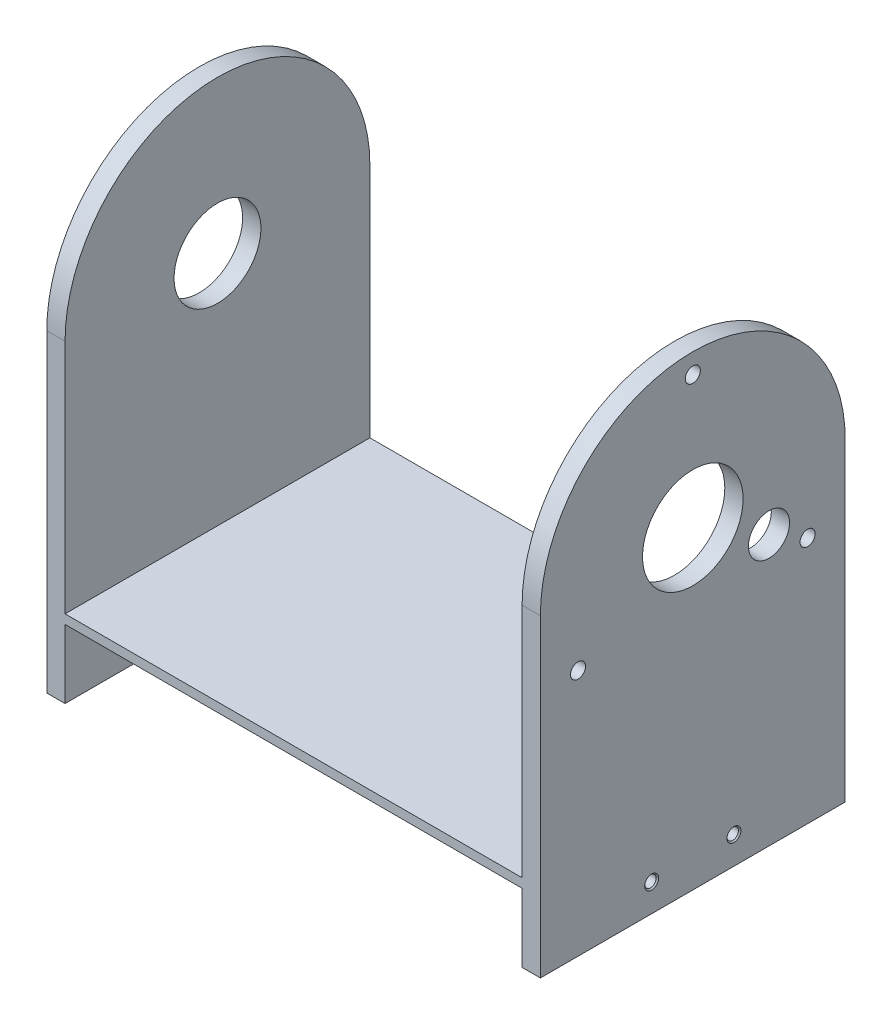
from build123d import *

# Parameters (mm, degrees)
SKETCH_1_W                   = 40
SKETCH_1_H                   = 66.7
EXTRUDE_1_DEPTH              = 2
SKETCH_2_W                   = 4
SKETCH_2_H                   = 66.7
EXTRUDE_2_DEPTH              = 100
CUT_EXTRUDE_1_DEPTH          = 115.526077816
CUT_EXTRUDE_1_DEPTH_BACK     = 115.526077816
HOLE_WIZARD_M4_1_D           = 3.3
HOLE_WIZARD_M4_1_CSINK_D     = 4.05
HOLE_WIZARD_M4_1_CSINK_ANGLE = 90
HOLE_WIZARD_M4_2_AT_2_COUNT  = 2
HOLE_WIZARD_M4_2_AT_2_PITCH  = 68.59294731
HOLE_WIZARD_M4_2_AT_3_COUNT  = 2
HOLE_WIZARD_M4_2_AT_3_PITCH  = 26
HOLE_WIZARD_M4_2_AT_4_COUNT  = 2
HOLE_WIZARD_M4_2_AT_4_PITCH  = 62.376998966
HOLE_WIZARD_M4_2_AT_5_COUNT  = 2
HOLE_WIZARD_M4_2_AT_5_PITCH  = 56.7
SKETCH_11_W                  = 66.7
SKETCH_11_H                  = 2
EXTRUDE_3_DEPTH              = 100
SKETCH_13_W                  = 40
SKETCH_13_H                  = 66.7
EXTRUDE_4_DEPTH              = 2
SKETCH_14_W                  = 4
SKETCH_14_H                  = 66.7
EXTRUDE_5_DEPTH              = 100
CUT_EXTRUDE_2_DEPTH          = 180.589037806
CUT_EXTRUDE_2_DEPTH_BACK     = 180.589037806
HOLE_WIZARD_M4_3_AT_2_COUNT  = 2
HOLE_WIZARD_M4_3_AT_2_PITCH  = 26
HOLE_WIZARD_M4_3_AT_3_COUNT  = 2
HOLE_WIZARD_M4_3_AT_3_PITCH  = 62.376998966
HOLE_WIZARD_M4_3_AT_4_COUNT  = 2
HOLE_WIZARD_M4_3_AT_4_PITCH  = 56.7
CUT_EXTRUDE_3_REACH          = 181.589
SKETCH_18_R                  = 9.5
CUT_EXTRUDE_4_REACH          = 181.589
SKETCH_21_R                  = 11
CUT_EXTRUDE_5_REACH          = 181.589
SKETCH_22_R                  = 4.5
FILLET_1_R                   = 2
CUT_EXTRUDE_6_REACH          = 193.604
SKETCH_23_W                  = 36
SKETCH_23_H                  = 66.7
CUT_EXTRUDE_7_REACH          = 164.752
SKETCH_24_W                  = 36
SKETCH_24_H                  = 66.7
HOLE_WIZARD_M3_1_D           = 2.5
HOLE_WIZARD_M3_1_CSINK_D     = 3.05
HOLE_WIZARD_M3_1_CSINK_ANGLE = 90


with BuildPart() as part:
    # 草图1 → 凸台-拉伸1 (new body)
    with BuildSketch(Plane(origin=(0, 0, 0), x_dir=(1, 0, 0), z_dir=(0, 1, 0))):
        Rectangle(SKETCH_1_W, SKETCH_1_H)
    extrude(amount=EXTRUDE_1_DEPTH)

    # 草图2 → 凸台-拉伸2 (add)
    with BuildSketch(Plane(origin=(0, 2, 0), x_dir=(1, 0, 0), z_dir=(0, 1, 0))):
        with Locations((-18, 0)):
            Rectangle(SKETCH_2_W, SKETCH_2_H)
    extrude(amount=EXTRUDE_2_DEPTH)

    # 草图5 → 切除-拉伸1 (cut, two sides: drawn at the far end of the back side and taken through both)
    with BuildSketch(Plane.ZY.offset(20).offset(-CUT_EXTRUDE_1_DEPTH_BACK)):
        with BuildLine():
            ThreePointArc((0, 102), (23.582011153, 92.232011153), (33.35, 68.65))
            Line((33.35, 68.65), (33.35, 102))
            Line((33.35, 102), (0, 102))
        make_face()
        with BuildLine():
            ThreePointArc((-33.35, 68.65), (-23.582011153, 92.232011153), (0, 102))
            Line((0, 102), (-33.35, 102))
            Line((-33.35, 102), (-33.35, 68.65))
        make_face()
    extrude(amount=CUT_EXTRUDE_1_DEPTH + CUT_EXTRUDE_1_DEPTH_BACK, mode=Mode.SUBTRACT)

    # M4 螺纹孔1 (through all)
    with Locations(Plane.ZY.offset(20)):
        with Locations((0, 97.65), (25.11473671, 54.15), (-25.11473671, 54.15)):
            CounterSinkHole(HOLE_WIZARD_M4_1_D / 2, HOLE_WIZARD_M4_1_CSINK_D / 2, counter_sink_angle=HOLE_WIZARD_M4_1_CSINK_ANGLE)

    # 草图10 → M4 螺纹孔2 (revolve, cut)
    with BuildSketch(Plane(origin=(15, 2, -28.35), x_dir=(0, 0, 1), z_dir=(1, 0, 0))):
        Polygon((0, 0), (0, 2), (1.65, 2), (1.65, 0.375), (2.025, 0), align=None)
    hole_wizard_m4_2 = revolve(axis=Axis((15, 8.35, -28.35), (0, -1, 0)), mode=Mode.SUBTRACT)

    # M4 螺纹孔2 at 2: M4 螺纹孔2 ×2
    with Locations(*[Vector(-0.9508085645250022, 0, 0.3097790722852413) * (i * HOLE_WIZARD_M4_2_AT_2_PITCH) for i in range(1, HOLE_WIZARD_M4_2_AT_2_COUNT)]):
        add(hole_wizard_m4_2, mode=Mode.SUBTRACT)

    # M4 螺纹孔2 at 3: M4 螺纹孔2 ×2
    with Locations(*[(-i * HOLE_WIZARD_M4_2_AT_3_PITCH, 0, 0) for i in range(1, HOLE_WIZARD_M4_2_AT_3_COUNT)]):
        add(hole_wizard_m4_2, mode=Mode.SUBTRACT)

    # M4 螺纹孔2 at 4: M4 螺纹孔2 ×2
    with Locations(*[Vector(-0.4168203092647413, 0, 0.9089889052042635) * (i * HOLE_WIZARD_M4_2_AT_4_PITCH) for i in range(1, HOLE_WIZARD_M4_2_AT_4_COUNT)]):
        add(hole_wizard_m4_2, mode=Mode.SUBTRACT)

    # M4 螺纹孔2 at 5: M4 螺纹孔2 ×2
    with Locations(*[(0, 0, i * HOLE_WIZARD_M4_2_AT_5_PITCH) for i in range(1, HOLE_WIZARD_M4_2_AT_5_COUNT)]):
        add(hole_wizard_m4_2, mode=Mode.SUBTRACT)

    # 草图11 → 凸台-拉伸3 (add)
    with BuildSketch(Plane.ZY.offset(20)):
        with Locations((0, 16)):
            Rectangle(SKETCH_11_W, SKETCH_11_H)
    extrude(amount=EXTRUDE_3_DEPTH)



with BuildPart() as body_2:
    # 草图13 → 凸台-拉伸4 (new body)
    with BuildSketch(Plane(origin=(0, 0, 0), x_dir=(1, 0, 0), z_dir=(0, 1, 0))):
        with Locations((-140, 0)):
            Rectangle(SKETCH_13_W, SKETCH_13_H)
    extrude(amount=EXTRUDE_4_DEPTH)


with BuildPart() as part_1:
    add(part.part)

    add(body_2.part)  # 凸台-拉伸5 merges body 2
    # 草图14 → 凸台-拉伸5 (add)
    with BuildSketch(Plane(origin=(0, 2, 0), x_dir=(1, 0, 0), z_dir=(0, 1, 0))):
        with Locations((-122, 0)):
            Rectangle(SKETCH_14_W, SKETCH_14_H)
    extrude(amount=EXTRUDE_5_DEPTH)

    # 草图15 → 切除-拉伸2 (cut, two sides: drawn at the far end of the back side and taken through both)
    with BuildSketch(Plane.ZY.offset(124).offset(-CUT_EXTRUDE_2_DEPTH_BACK)):
        with BuildLine():
            ThreePointArc((0, 102), (23.582011153, 92.232011153), (33.35, 68.65))
            Line((33.35, 68.65), (33.35, 102))
            Line((33.35, 102), (0, 102))
        make_face()
        with BuildLine():
            ThreePointArc((-33.35, 68.65), (-23.582011153, 92.232011153), (0, 102))
            Line((0, 102), (-33.35, 102))
            Line((-33.35, 102), (-33.35, 68.65))
        make_face()
    extrude(amount=CUT_EXTRUDE_2_DEPTH + CUT_EXTRUDE_2_DEPTH_BACK, mode=Mode.SUBTRACT)

    # 草图17 → M4 螺纹孔3 (revolve, cut)
    with BuildSketch(Plane(origin=(-129, 2, -28.35), x_dir=(0, 0, 1), z_dir=(1, 0, 0))):
        Polygon((0, 0), (0, 2), (1.65, 2), (1.65, 0.375), (2.025, 0), align=None)
    hole_wizard_m4_3 = revolve(axis=Axis((-129, 8.35, -28.35), (0, -1, 0)), mode=Mode.SUBTRACT)

    # M4 螺纹孔3 at 2: M4 螺纹孔3 ×2
    with Locations(*[(-i * HOLE_WIZARD_M4_3_AT_2_PITCH, 0, 0) for i in range(1, HOLE_WIZARD_M4_3_AT_2_COUNT)]):
        add(hole_wizard_m4_3, mode=Mode.SUBTRACT)

    # M4 螺纹孔3 at 3: M4 螺纹孔3 ×2
    with Locations(*[Vector(-0.41682030926474106, 0, 0.9089889052042636) * (i * HOLE_WIZARD_M4_3_AT_3_PITCH) for i in range(1, HOLE_WIZARD_M4_3_AT_3_COUNT)]):
        add(hole_wizard_m4_3, mode=Mode.SUBTRACT)

    # M4 螺纹孔3 at 4: M4 螺纹孔3 ×2
    with Locations(*[(0, 0, i * HOLE_WIZARD_M4_3_AT_4_PITCH) for i in range(1, HOLE_WIZARD_M4_3_AT_4_COUNT)]):
        add(hole_wizard_m4_3, mode=Mode.SUBTRACT)

    # 草图18 → 切除-拉伸3 (cut, up to next)
    with BuildSketch(Plane.ZY.offset(124), mode=Mode.PRIVATE) as cut_extrude_3_sk1:
        with Locations((0, 68.65)):
            Circle(SKETCH_18_R)
    cut_extrude_3_tool1 = extrude(cut_extrude_3_sk1.sketch, amount=-CUT_EXTRUDE_3_REACH, mode=Mode.PRIVATE) & part_1.part
    add(cut_extrude_3_tool1.solids().sort_by_distance((-124, 68.65, 0))[0], mode=Mode.SUBTRACT)

    # 草图21 → 切除-拉伸4 (cut, up to next)
    with BuildSketch(Plane(origin=(-16, 0, 0), x_dir=(0, 0, -1), z_dir=(1, 0, 0)), mode=Mode.PRIVATE) as cut_extrude_4_sk1:
        with Locations((0, 68.65)):
            Circle(SKETCH_21_R)
    cut_extrude_4_tool1 = extrude(cut_extrude_4_sk1.sketch, amount=-CUT_EXTRUDE_4_REACH, mode=Mode.PRIVATE) & part_1.part
    add(cut_extrude_4_tool1.solids().sort_by_distance((-16, 68.65, 0))[0], mode=Mode.SUBTRACT)

    # 草图22 → 切除-拉伸5 (cut, up to next)
    with BuildSketch(Plane(origin=(-16, 0, 0), x_dir=(0, 0, -1), z_dir=(1, 0, 0)), mode=Mode.PRIVATE) as cut_extrude_5_sk1:
        with Locations((16.670989023, 59.025)):
            Circle(SKETCH_22_R)
    cut_extrude_5_tool1 = extrude(cut_extrude_5_sk1.sketch, amount=-CUT_EXTRUDE_5_REACH, mode=Mode.PRIVATE) & part_1.part
    add(cut_extrude_5_tool1.solids().sort_by_distance((-16, 59.025, -16.670989))[0], mode=Mode.SUBTRACT)

    # 圆角1
    fillet_1_edges = [part_1.edges().sort_by_distance(p)[0] for p in [
        (-160, 1, -33.35),
        (-160, 1, 33.35),
        (20, 1, 33.35),
        (20, 1, -33.35),
    ]]
    fillet(fillet_1_edges, radius=FILLET_1_R)

    # 草图23 → 切除-拉伸6 (cut, up to next)
    with BuildSketch(Plane(origin=(0, 2, 0), x_dir=(1, 0, 0), z_dir=(0, 1, 0)), mode=Mode.PRIVATE) as cut_extrude_6_sk1:
        with Locations((-142, 0)):
            Rectangle(SKETCH_23_W, SKETCH_23_H)
    cut_extrude_6_tool1 = extrude(cut_extrude_6_sk1.sketch, amount=-CUT_EXTRUDE_6_REACH, mode=Mode.PRIVATE) & part_1.part
    add(cut_extrude_6_tool1.solids().sort_by_distance((-142, 2, 0))[0], mode=Mode.SUBTRACT)

    # 草图24 → 切除-拉伸7 (cut, up to next)
    with BuildSketch(Plane(origin=(0, 2, 0), x_dir=(1, 0, 0), z_dir=(0, 1, 0)), mode=Mode.PRIVATE) as cut_extrude_7_sk1:
        with Locations((2, 0)):
            Rectangle(SKETCH_24_W, SKETCH_24_H)
    cut_extrude_7_tool1 = extrude(cut_extrude_7_sk1.sketch, amount=-CUT_EXTRUDE_7_REACH, mode=Mode.PRIVATE) & part_1.part
    add(cut_extrude_7_tool1.solids().sort_by_distance((2, 2, 0))[0], mode=Mode.SUBTRACT)

    # M3 螺纹孔1 (through all)
    with Locations(Plane(origin=(-16, 0, 0), x_dir=(0, 0, -1), z_dir=(1, 0, 0))):
        with Locations((9, 6), (-9, 6)):
            CounterSinkHole(HOLE_WIZARD_M3_1_D / 2, HOLE_WIZARD_M3_1_CSINK_D / 2, counter_sink_angle=HOLE_WIZARD_M3_1_CSINK_ANGLE)


solid = part_1.part
